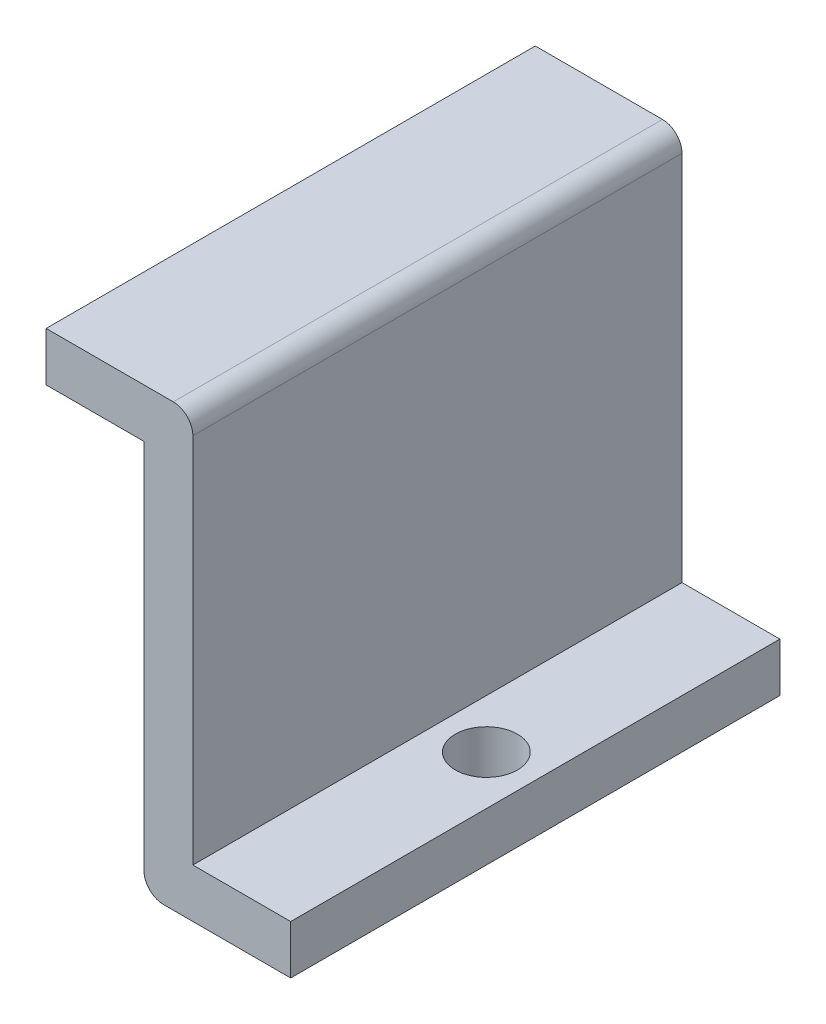
from build123d import *

# Parameters (mm, degrees)
SALIENTE_EXTRUIR1_DEPTH = 50
CORTAR_EXTRUIR1_REACH   = 70.92
CROQUIS2_R              = 3.175


with BuildPart() as part:
    # Croquis1 → Saliente-Extruir1 (new body)
    with BuildSketch(Plane.XY):
        with BuildLine():
            Line((0, 0), (0, 9))
            Line((0, 9), (0, 18))
            ThreePointArc((0, 18), (-0.585786438, 19.414213562), (-2, 20))
            Line((-2, 20), (-8.5, 20))
            Line((-8.5, 20), (-15, 20))
            Line((-15, 20), (-15, 15))
            Line((-15, 15), (-5, 15))
            Line((-5, 15), (-5, 0))
            Line((-5, 0), (-5, -23))
            ThreePointArc((-5, -23), (-4.414213562, -24.414213562), (-3, -25))
            Line((-3, -25), (10, -25))
            Line((10, -25), (10, -20))
            Line((10, -20), (0, -20))
            Line((0, -20), (0, 0))
        make_face()
    extrude(amount=SALIENTE_EXTRUIR1_DEPTH)

    # Croquis2 → Cortar-Extruir1 (cut, up to next)
    with BuildSketch(Plane.XZ.offset(25), mode=Mode.PRIVATE) as cortar_extruir1_sk1:
        with Locations(Location((5, 25, 0), (0, 0, 270))):
            Circle(CROQUIS2_R)
    cortar_extruir1_tool1 = extrude(cortar_extruir1_sk1.sketch, amount=-CORTAR_EXTRUIR1_REACH, mode=Mode.PRIVATE) & part.part
    add(cortar_extruir1_tool1.solids().sort_by_distance((5, -25, 25))[0], mode=Mode.SUBTRACT)


solid = part.part
